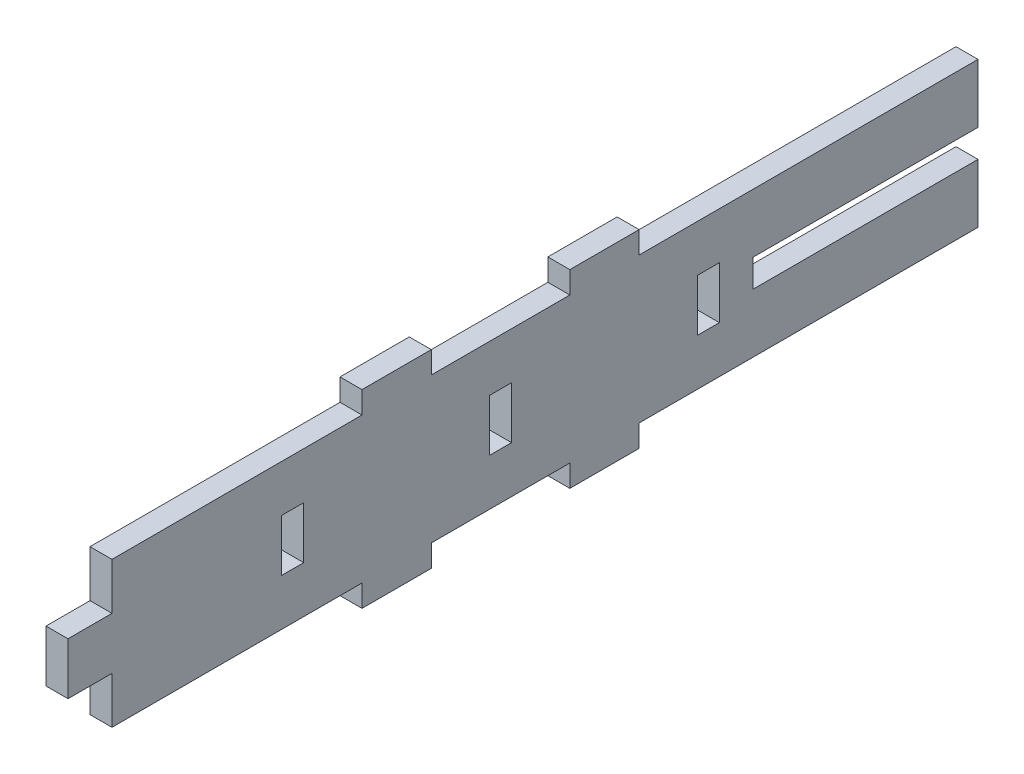
from build123d import *

# Parameters (mm, degrees)
SKETCH1_W           = 250
SKETCH1_H           = 42
SKETCH1_W_2         = 12.7
SKETCH1_H_2         = 15
BOSS_EXTRUDE1_DEPTH = 6.35
SKETCH2_W           = 6.35
SKETCH2_H           = 15
CUT_EXTRUDE1_DEPTH  = 140.436768824
LPATTERN1_COUNT     = 3
LPATTERN1_PITCH     = 60
SKETCH3_W           = 65
SKETCH3_H           = 8
CUT_EXTRUDE2_DEPTH  = 140.436768824
SKETCH4_W           = 20
SKETCH4_H           = 6.35
BOSS_EXTRUDE2_DEPTH = 6.35


with BuildPart() as part:
    # Sketch1 → Boss-Extrude1 (new body)
    with BuildSketch(Plane(origin=(0, 0, 0), x_dir=(0, 0, -1), z_dir=(1, 0, 0))):
        Rectangle(SKETCH1_W, SKETCH1_H)
        with Locations((-131.35, 0)):
            Rectangle(SKETCH1_W_2, SKETCH1_H_2)
    extrude(amount=BOSS_EXTRUDE1_DEPTH)

    # Sketch2 → Cut-Extrude1 (cut, through all)
    with BuildSketch(Plane(origin=(6.35, 0, 0), x_dir=(0, 0, -1), z_dir=(1, 0, 0))):
        with Locations((-72.825, 0)):
            Rectangle(SKETCH2_W, SKETCH2_H)
    cut_extrude1 = extrude(amount=-CUT_EXTRUDE1_DEPTH, mode=Mode.SUBTRACT)

    # LPattern1: Cut-Extrude1 ×3
    with Locations(*[(0, 0, -i * LPATTERN1_PITCH) for i in range(1, LPATTERN1_COUNT)]):
        add(cut_extrude1, mode=Mode.SUBTRACT)

    # Sketch3 → Cut-Extrude2 (cut, through all)
    with BuildSketch(Plane(origin=(6.35, 0, 0), x_dir=(0, 0, -1), z_dir=(1, 0, 0))):
        with Locations((92.5, 0)):
            Rectangle(SKETCH3_W, SKETCH3_H)
    extrude(amount=-CUT_EXTRUDE2_DEPTH, mode=Mode.SUBTRACT)

    # Sketch4 → Boss-Extrude2 (add)
    with BuildSketch(Plane(origin=(6.35, 0, 0), x_dir=(0, 0, -1), z_dir=(1, 0, 0))):
        with Locations((-42.825, 24.175)):
            Rectangle(SKETCH4_W, SKETCH4_H)
        with Locations((17.175, 24.175)):
            Rectangle(SKETCH4_W, SKETCH4_H)
    boss_extrude2 = extrude(amount=-BOSS_EXTRUDE2_DEPTH)

    # Mirror1: Boss-Extrude2 across plane
    add(boss_extrude2.mirror(Plane.ZX))


solid = part.part
